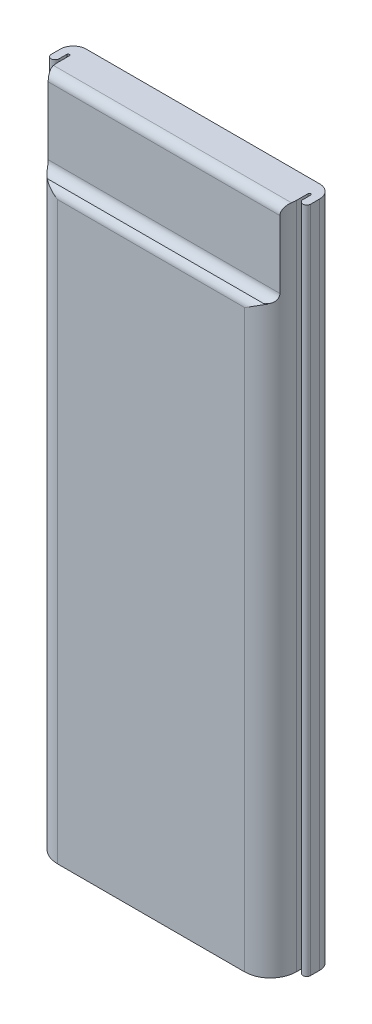
from build123d import *

# Parameters (mm, degrees)
EXTRUDE_1_DEPTH                 = 25.75
CUT_EXTRUDE_1_REACH             = 29.912
CUT_EXTRUDE_1_DIRECTION_2_REACH = 29.912


with BuildPart() as part:
    # Эскиз1 → Бобышка-Вытянуть1 (new, symmetric)
    with BuildSketch(Plane(origin=(0, 0, 0), x_dir=(1, 0, 0), z_dir=(0, 1, 0))):
        with BuildLine():
            Line((-9, 0), (9, 0))
            ThreePointArc((9, 0), (9.707106781, -0.292893219), (10, -1))
            Line((10, -1), (10, -1.7))
            ThreePointArc((10, -1.7), (9.7, -2), (9.4, -1.7))
            Line((9.4, -1.7), (9.4, -1.1))
            ThreePointArc((9.4, -1.1), (9.3, -1), (9.2, -1.1))
            Line((9.2, -1.1), (9.2, -2))
            ThreePointArc((9.2, -2), (8.614213562, -3.414213562), (7.2, -4))
            Line((7.2, -4), (-7.2, -4))
            ThreePointArc((-7.2, -4), (-8.614213562, -3.414213562), (-9.2, -2))
            Line((-9.2, -2), (-9.2, -1.1))
            ThreePointArc((-9.2, -1.1), (-9.3, -1), (-9.4, -1.1))
            Line((-9.4, -1.1), (-9.4, -1.7))
            ThreePointArc((-9.4, -1.7), (-9.7, -2), (-10, -1.7))
            Line((-10, -1.7), (-10, -1))
            ThreePointArc((-10, -1), (-9.707106781, -0.292893219), (-9, 0))
        make_face()
    extrude(amount=EXTRUDE_1_DEPTH, both=True)

    # Эскиз2 → Вырез-Вытянуть1 (cut, up to next)
    with BuildSketch(Plane(origin=(0, 0, 0), x_dir=(0, 0, -1), z_dir=(1, 0, 0)), mode=Mode.PRIVATE) as cut_extrude_1_sk1:
        with BuildLine():
            Line((-3, 25.1), (-3, 19.9))
            ThreePointArc((-3, 19.9), (-3.190380592, 19.440380592), (-3.65, 19.25))
            Line((-3.65, 19.25), (-3.35, 19.25))
            ThreePointArc((-3.35, 19.25), (-3.809619408, 19.059619408), (-4, 18.6))
            Line((-4, 18.6), (-4, 25.75))
            Line((-4, 25.75), (-2.35, 25.75))
            ThreePointArc((-2.35, 25.75), (-2.809619408, 25.559619408), (-3, 25.1))
        make_face()
    cut_extrude_1_tool1 = extrude(cut_extrude_1_sk1.sketch, amount=-CUT_EXTRUDE_1_REACH, mode=Mode.PRIVATE) & part.part
    add(cut_extrude_1_tool1.solids().sort_by_distance((0, 22.538719, 3.500886))[0], mode=Mode.SUBTRACT)

    # Эскиз2 → Вырез-Вытянуть1 direction 2 (cut, up to next)
    with BuildSketch(Plane(origin=(0, 0, 0), x_dir=(0, 0, -1), z_dir=(1, 0, 0)), mode=Mode.PRIVATE) as cut_extrude_1_direction_2_sk1:
        with BuildLine():
            Line((-3, 25.1), (-3, 19.9))
            ThreePointArc((-3, 19.9), (-3.190380592, 19.440380592), (-3.65, 19.25))
            Line((-3.65, 19.25), (-3.35, 19.25))
            ThreePointArc((-3.35, 19.25), (-3.809619408, 19.059619408), (-4, 18.6))
            Line((-4, 18.6), (-4, 25.75))
            Line((-4, 25.75), (-2.35, 25.75))
            ThreePointArc((-2.35, 25.75), (-2.809619408, 25.559619408), (-3, 25.1))
        make_face()
    cut_extrude_1_direction_2_tool1 = extrude(cut_extrude_1_direction_2_sk1.sketch, amount=CUT_EXTRUDE_1_DIRECTION_2_REACH, mode=Mode.PRIVATE) & part.part
    add(cut_extrude_1_direction_2_tool1.solids().sort_by_distance((0, 22.538719, 3.500886))[0], mode=Mode.SUBTRACT)


solid = part.part
